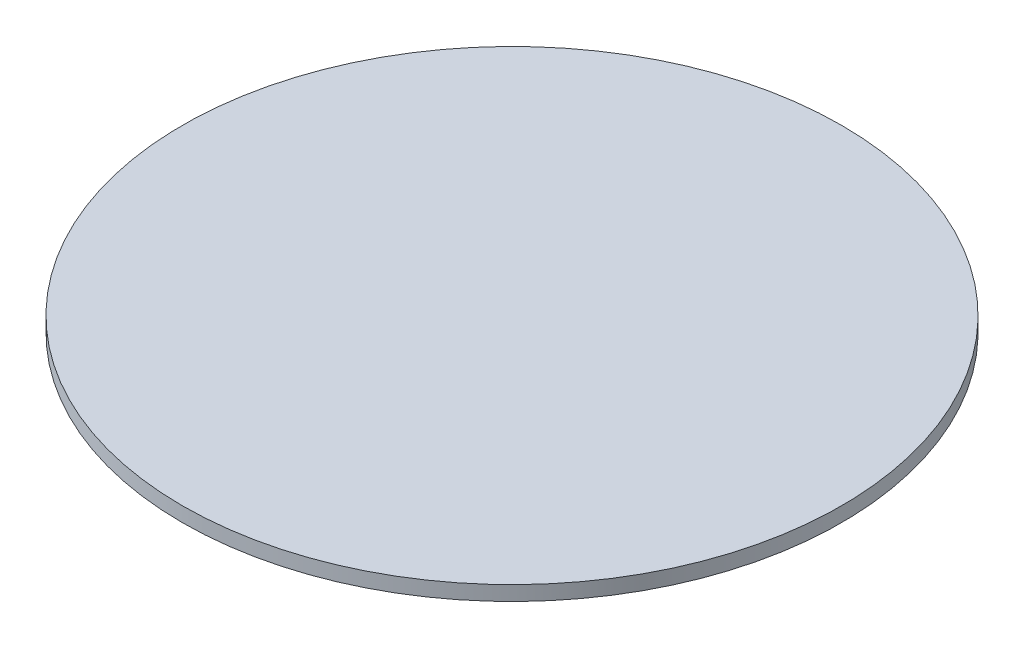
from build123d import *

# Parameters (mm, degrees)
SKETCH1_R           = 45
BOSS_EXTRUDE1_DEPTH = 2


with BuildPart() as part:
    # Sketch1 → Boss-Extrude1 (new body)
    with BuildSketch(Plane(origin=(0, 0, 0), x_dir=(1, 0, 0), z_dir=(0, 1, 0))):
        with Locations(Location((0, 0, 0), (0, 0, 270))):
            Circle(SKETCH1_R)
    extrude(amount=BOSS_EXTRUDE1_DEPTH)


solid = part.part
